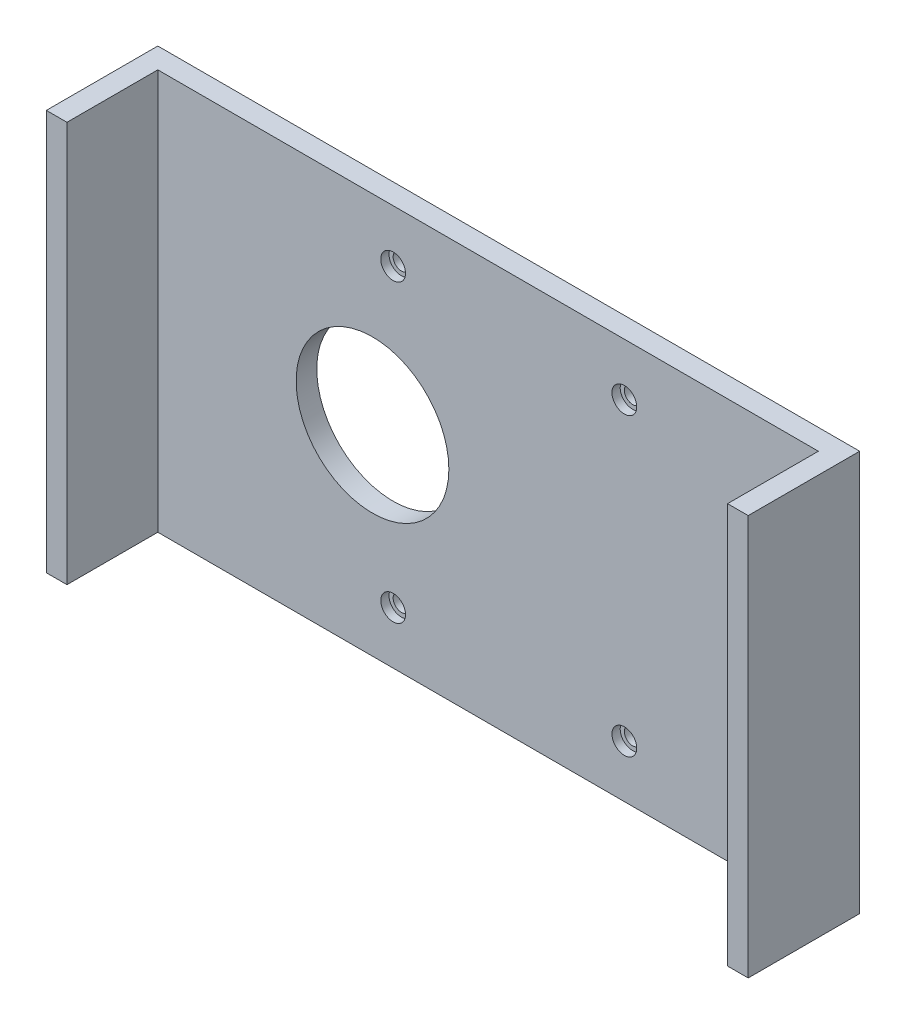
from build123d import *

# Parameters (mm, degrees)
SKETCH_1_W               = 170
SKETCH_1_H               = 97
EXTRUDE_1_DEPTH          = 27
CUT_EXTRUDE_1_DEPTH      = 198.580363397
CUT_EXTRUDE_1_DEPTH_BACK = 198.580363397
SKETCH_4_W               = 2
SKETCH_4_H               = 2
CUT_EXTRUDE_2_DEPTH      = 198.580363397
SKETCH_5_R               = 18.5
SKETCH_5_R_2             = 2
CUT_EXTRUDE_3_DEPTH      = 197.959386677
SKETCH_6_R               = 3
CUT_EXTRUDE_4_DEPTH      = 2


with BuildPart() as part:
    # 草图1 → 凸台-拉伸1 (new body)
    with BuildSketch(Plane.XY):
        with Locations((-85, -48.5)):
            Rectangle(SKETCH_1_W, SKETCH_1_H)
    extrude(amount=EXTRUDE_1_DEPTH)

    # 草图2 → 切除-拉伸1 (cut, two sides: drawn at the far end of the back side and taken through both)
    with BuildSketch(Plane(origin=(0, 0, 0), x_dir=(1, 0, 0), z_dir=(0, 1, 0)).offset(-CUT_EXTRUDE_1_DEPTH_BACK)):
        Polygon((-5, -5), (-165, -5), (-165, -25), (-163, -25), (-163, -27), (-7, -27), (-7, -25), (-5, -25), align=None)
    extrude(amount=CUT_EXTRUDE_1_DEPTH + CUT_EXTRUDE_1_DEPTH_BACK, mode=Mode.SUBTRACT)

    # 草图4 → 切除-拉伸2 (cut, through all)
    with BuildSketch(Plane(origin=(0, 0, 0), x_dir=(1, 0, 0), z_dir=(0, 1, 0))):
        with Locations((-6, -26)):
            Rectangle(SKETCH_4_W, SKETCH_4_H)
        with Locations((-164, -26)):
            Rectangle(SKETCH_4_W, SKETCH_4_H)
    extrude(amount=-CUT_EXTRUDE_2_DEPTH, mode=Mode.SUBTRACT)

    # 草图5 → 切除-拉伸3 (cut, through all)
    with BuildSketch(Plane.XY.offset(5)):
        with Locations((-113, -48.5)):
            Circle(SKETCH_5_R)
        with Locations((-108, -12.7)):
            Circle(SKETCH_5_R_2)
        with Locations((-108, -84.3)):
            Circle(SKETCH_5_R_2)
        with Locations((-52, -12.7)):
            Circle(SKETCH_5_R_2)
        with Locations((-52, -84.3)):
            Circle(SKETCH_5_R_2)
    extrude(amount=-CUT_EXTRUDE_3_DEPTH, mode=Mode.SUBTRACT)

    # 草图6 → 切除-拉伸4 (cut)
    with BuildSketch(Plane.XY.offset(5)):
        with Locations((-108, -12.7)):
            Circle(SKETCH_6_R)
        with Locations((-52, -12.7)):
            Circle(SKETCH_6_R)
        with Locations((-108, -84.3)):
            Circle(SKETCH_6_R)
        with Locations((-52, -84.3)):
            Circle(SKETCH_6_R)
    extrude(amount=-CUT_EXTRUDE_4_DEPTH, mode=Mode.SUBTRACT)


solid = part.part
